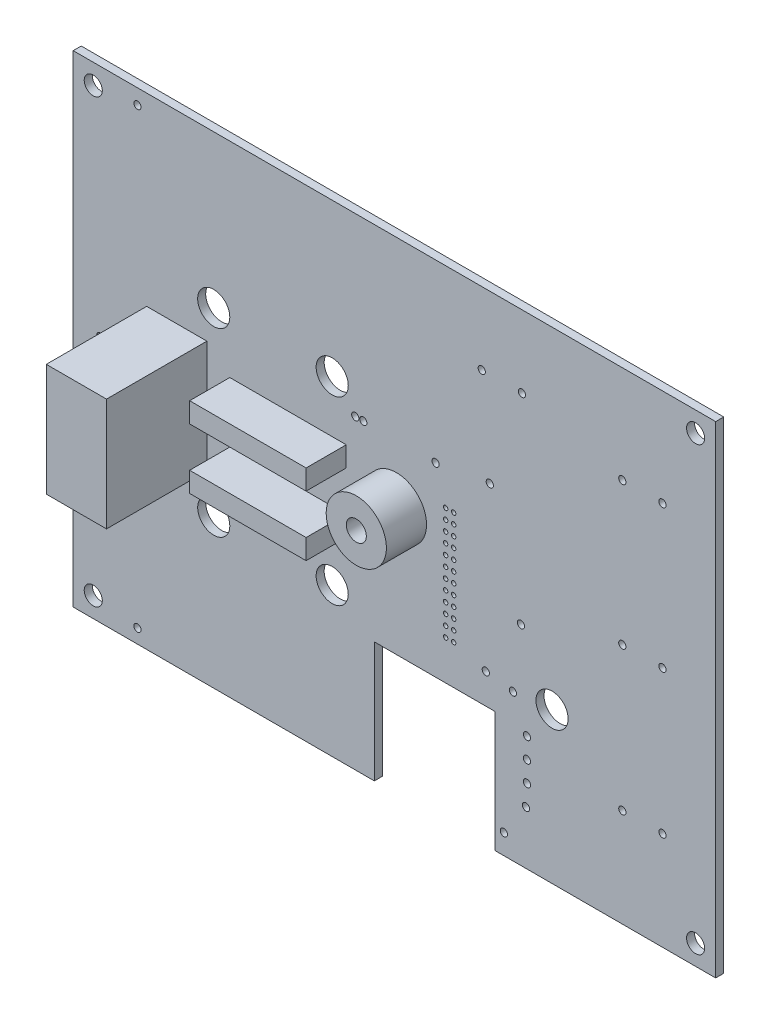
from build123d import *

# Parameters (mm, degrees)
SKETCH_1_R                  = 2.25
SKETCH_1_R_2                = 4
EXTRUDE_1_DEPTH             = 2
SKETCH_3_R                  = 0.55
CUT_EXTRUDE_1_DEPTH         = 2
PATTERN_LINEAR_1_COUNT      = 2
PATTERN_LINEAR_1_PITCH      = 2
PATTERN_LINEAR_1_COUNT_DIR2 = 12
PATTERN_LINEAR_1_PITCH_DIR2 = 2.54
SKETCH_4_R                  = 0.9
CUT_EXTRUDE_2_DEPTH         = 2
SKETCH_5_R                  = 0.9
CUT_EXTRUDE_3_DEPTH         = 10
SKETCH_6_R                  = 7.5
SKETCH_6_R_2                = 2.5
SKETCH_6_W                  = 15
SKETCH_6_H                  = 28
SKETCH_6_W_2                = 29
SKETCH_6_H_2                = 5
EXTRUDE_2_DEPTH             = 10
SKETCH_7_W                  = 15
SKETCH_7_H                  = 28
EXTRUDE_3_DEPTH             = 15
SKETCH_8_R                  = 2.5
EXTRUDE_4_DEPTH             = 15.5
SKETCH_9_R                  = 3
EXTRUDE_5_DEPTH             = 5
SKETCH_10_R                 = 3
SKETCH_10_R_2               = 0.3
CUT_EXTRUDE_4_DEPTH         = 4.5
CHAMFER_1_SIZE              = 0.5


with BuildPart() as part:
    # Эскиз1 → Вытянуть1 (new body)
    with BuildSketch(Plane.XY):
        Polygon((10, -60), (65, -60), (65, 60), (-95, 60), (-95, -60), (-20, -60), (-20, -30), (10, -30), align=None)
        with Locations((-90, 55)):
            Circle(SKETCH_1_R, mode=Mode.SUBTRACT)
        with Locations((60, 55)):
            Circle(SKETCH_1_R, mode=Mode.SUBTRACT)
        with Locations((60, -55)):
            Circle(SKETCH_1_R, mode=Mode.SUBTRACT)
        with Locations((-90, -55)):
            Circle(SKETCH_1_R, mode=Mode.SUBTRACT)
        with Locations((-60, 22)):
            Circle(SKETCH_1_R_2, mode=Mode.SUBTRACT)
        with Locations((-30.5, 22)):
            Circle(SKETCH_1_R_2, mode=Mode.SUBTRACT)
        with Locations((-30.5, -23)):
            Circle(SKETCH_1_R_2, mode=Mode.SUBTRACT)
        with Locations((-60, -23)):
            Circle(SKETCH_1_R_2, mode=Mode.SUBTRACT)
        with Locations((24.25, -22.5)):
            Circle(SKETCH_1_R_2, mode=Mode.SUBTRACT)
    extrude(amount=EXTRUDE_1_DEPTH)

    # Эскиз3 → Вырез-Вытянуть1 (cut)
    with BuildSketch(Plane.XY.offset(2)):
        with Locations((-2.25, 7.75)):
            Circle(SKETCH_3_R)
    cut_extrude_1 = extrude(amount=-CUT_EXTRUDE_1_DEPTH, mode=Mode.SUBTRACT)

    # Линейный массив1: Cut-Extrude 1 2 × 12
    with Locations(*[(i * PATTERN_LINEAR_1_PITCH, -j * PATTERN_LINEAR_1_PITCH_DIR2, 0) for i in range(PATTERN_LINEAR_1_COUNT) for j in range(PATTERN_LINEAR_1_COUNT_DIR2) if (i, j) != (0, 0)]):
        add(cut_extrude_1, mode=Mode.SUBTRACT)

    # Эскиз4 → Вырез-Вытянуть2 (cut)
    with BuildSketch(Plane.XY.offset(2)):
        with Locations((17.75, -46.75)):
            Circle(SKETCH_4_R)
        with Locations((-24.75, 16.23)):
            Circle(SKETCH_4_R)
        with Locations((-88.25, 1.58)):
            Circle(SKETCH_4_R)
        with Locations((18, -41.5)):
            Circle(SKETCH_4_R)
        with Locations((14.5, -23.5)):
            Circle(SKETCH_4_R)
        with Locations((18, -36.42)):
            Circle(SKETCH_4_R)
        with Locations((-22.75, 16.23)):
            Circle(SKETCH_4_R)
        with Locations((-4.75, 16.23)):
            Circle(SKETCH_4_R)
        with Locations((18, -31.34)):
            Circle(SKETCH_4_R)
        with Locations((-88.25, -3.5)):
            Circle(SKETCH_4_R)
    extrude(amount=-CUT_EXTRUDE_2_DEPTH, mode=Mode.SUBTRACT)

    # Эскиз5 → Вырез-Вытянуть3 (cut)
    with BuildSketch(Plane.XY.offset(2)):
        with Locations((41.75, 35.75)):
            Circle(SKETCH_5_R)
        with Locations((51.75, 35.75)):
            Circle(SKETCH_5_R)
        with Locations((6.75, 42)):
            Circle(SKETCH_5_R)
        with Locations((16.75, 42)):
            Circle(SKETCH_5_R)
        with Locations((41.75, -35.5)):
            Circle(SKETCH_5_R)
        with Locations((51.75, -35.5)):
            Circle(SKETCH_5_R)
        with Locations((41.75, 0.25)):
            Circle(SKETCH_5_R)
        with Locations((51.75, 0.25)):
            Circle(SKETCH_5_R)
        with Locations((12.25, -55)):
            Circle(SKETCH_5_R)
        with Locations((-79, 56.25)):
            Circle(SKETCH_5_R)
        with Locations(Location((-79, -56.5, 0), (0, 0, 180))):
            Circle(SKETCH_5_R)
        with Locations((8.75, 18.5)):
            Circle(SKETCH_5_R)
        with Locations((16.5, -8)):
            Circle(SKETCH_5_R)
        with Locations((7.75, -22.5)):
            Circle(SKETCH_5_R)
    extrude(amount=-CUT_EXTRUDE_3_DEPTH, mode=Mode.SUBTRACT)

    # Эскиз6 → Вытянуть2 (add)
    # profile 1 of 4: a face of its own
    with BuildSketch(Plane.XY.offset(2)):
        with Locations(Location((-14.5, 1.75, 0), (0, 0, 180))):
            Circle(SKETCH_6_R)
        with Locations((-14.5, 1.75)):
            Circle(SKETCH_6_R_2, mode=Mode.SUBTRACT)
    # profile 2 of 4: a face of its own
    with BuildSketch(Plane.XY.offset(2)):
        with Locations((-69.2, 0)):
            Rectangle(SKETCH_6_W, SKETCH_6_H)
    # profile 3 of 4: a face of its own
    with BuildSketch(Plane.XY.offset(2)):
        with Locations((-41.5, 6.5)):
            Rectangle(SKETCH_6_W_2, SKETCH_6_H_2)
    # profile 4 of 4: a face of its own
    with BuildSketch(Plane.XY.offset(2)):
        with Locations((-41.5, -8.5)):
            Rectangle(SKETCH_6_W_2, SKETCH_6_H_2)
    extrude(amount=EXTRUDE_2_DEPTH)

    # Эскиз7 → Вытянуть3 (add)
    with BuildSketch(Plane.XY.offset(12)):
        with Locations((-69.2, 0)):
            Rectangle(SKETCH_7_W, SKETCH_7_H)
    extrude(amount=EXTRUDE_3_DEPTH)

    # Эскиз8 → Вытянуть4 (add)
    with BuildSketch(Plane.XY.offset(2)):
        with Locations((-8.5, -18)):
            Circle(SKETCH_8_R)
    extrude(amount=-EXTRUDE_4_DEPTH)

    # Эскиз9 → Вытянуть5 (add)
    with BuildSketch(Plane(origin=(0, 0, 0), x_dir=(-1, 0, 0), z_dir=(0, 0, -1))):
        with Locations((8.5, -18)):
            Circle(SKETCH_9_R)
    extrude(amount=EXTRUDE_5_DEPTH)

    # Эскиз10 → Вырез-Вытянуть4 (cut)
    with BuildSketch(Plane.XY):
        with Locations((-8.5, -18)):
            Circle(SKETCH_10_R)
        with Locations((-8.5, -16.496281754)):
            Circle(SKETCH_10_R_2, mode=Mode.SUBTRACT)
        with Locations((-9.77, -19.036281754)):
            Circle(SKETCH_10_R_2, mode=Mode.SUBTRACT)
        with Locations((-7.23, -19.036281754)):
            Circle(SKETCH_10_R_2, mode=Mode.SUBTRACT)
    extrude(amount=-CUT_EXTRUDE_4_DEPTH, mode=Mode.SUBTRACT)

    # Фаска1
    chamfer_1_edges = [part.edges().sort_by_distance(p)[0] for p in [
        (-11, -18, -13.5),
    ]]
    chamfer(chamfer_1_edges, length=CHAMFER_1_SIZE)


solid = part.part
